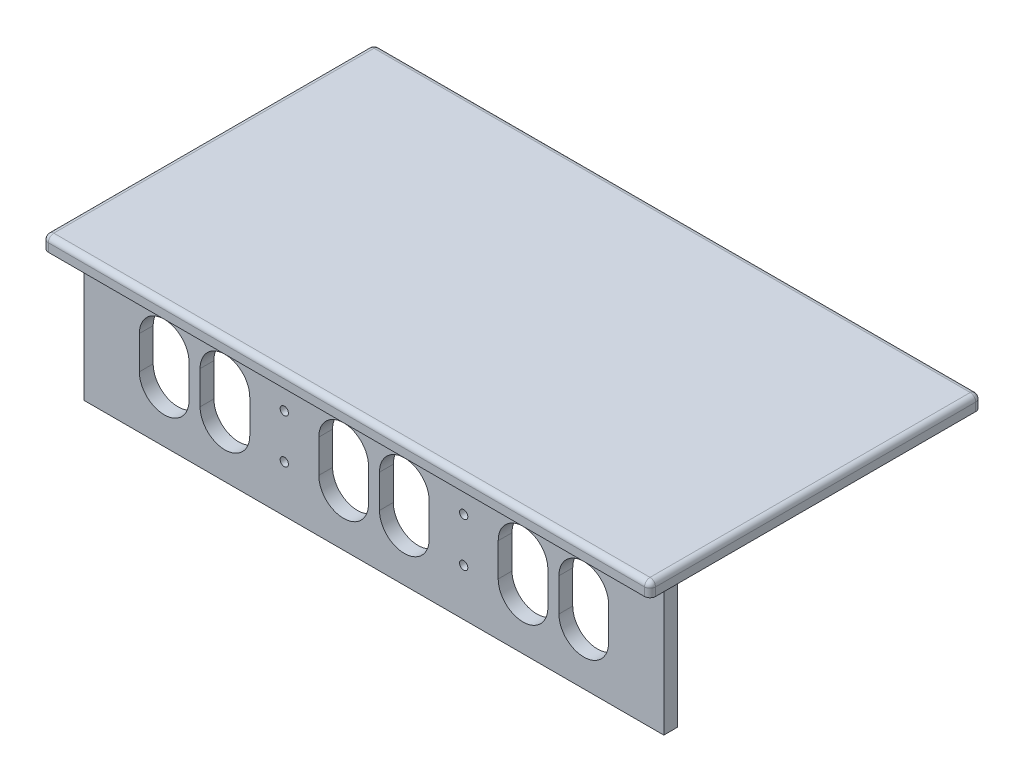
from build123d import *

# Parameters (mm, degrees)
CROQUIS1_W              = 220
CROQUIS1_H              = 120
SALIENTE_EXTRUIR1_DEPTH = 5
CROQUIS2_W              = 210
CROQUIS2_H              = 5
SALIENTE_EXTRUIR2_DEPTH = 50
CORTAR_EXTRUIR1_REACH   = 165.401
REDONDEO1_R             = 2
CORTAR_EXTRUIR3_REACH   = 165.401
CROQUIS11_R             = 1.5


with BuildPart() as part:
    # Croquis1 → Saliente-Extruir1 (new body)
    with BuildSketch(Plane(origin=(0, 0, 0), x_dir=(1, 0, 0), z_dir=(0, 1, 0))):
        Rectangle(CROQUIS1_W, CROQUIS1_H)
    extrude(amount=SALIENTE_EXTRUIR1_DEPTH)

    # Croquis2 → Saliente-Extruir2 (add)
    with BuildSketch(Plane.XZ):
        with Locations((0, 47.5)):
            Rectangle(CROQUIS2_W, CROQUIS2_H)
    extrude(amount=SALIENTE_EXTRUIR2_DEPTH)

    # Croquis3 → Cortar-Extruir1 (cut, up to next)
    with BuildSketch(Plane.XY.offset(50), mode=Mode.PRIVATE) as cortar_extruir1_sk1:
        with BuildLine():
            Line((-45, -19), (-45, -31))
            ThreePointArc((-45, -31), (-54, -40), (-63, -31))
            Line((-63, -31), (-63, -19))
            ThreePointArc((-63, -19), (-54, -10), (-45, -19))
        make_face()
    cortar_extruir1_tool1 = extrude(cortar_extruir1_sk1.sketch, amount=-CORTAR_EXTRUIR1_REACH, mode=Mode.PRIVATE) & part.part
    # Croquis3 → Cortar-Extruir1 (cut, up to next)
    with BuildSketch(Plane.XY.offset(50), mode=Mode.PRIVATE) as cortar_extruir1_sk2:
        with BuildLine():
            Line((-85, -19), (-85, -31))
            ThreePointArc((-85, -31), (-76, -40), (-67, -31))
            Line((-67, -31), (-67, -19))
            ThreePointArc((-67, -19), (-76, -10), (-85, -19))
        make_face()
    cortar_extruir1_tool2 = extrude(cortar_extruir1_sk2.sketch, amount=-CORTAR_EXTRUIR1_REACH, mode=Mode.PRIVATE) & part.part
    # Croquis3 → Cortar-Extruir1 (cut, up to next)
    with BuildSketch(Plane.XY.offset(50), mode=Mode.PRIVATE) as cortar_extruir1_sk3:
        with BuildLine():
            Line((20, -19), (20, -31))
            ThreePointArc((20, -31), (11, -40), (2, -31))
            Line((2, -31), (2, -19))
            ThreePointArc((2, -19), (11, -10), (20, -19))
        make_face()
    cortar_extruir1_tool3 = extrude(cortar_extruir1_sk3.sketch, amount=-CORTAR_EXTRUIR1_REACH, mode=Mode.PRIVATE) & part.part
    # Croquis3 → Cortar-Extruir1 (cut, up to next)
    with BuildSketch(Plane.XY.offset(50), mode=Mode.PRIVATE) as cortar_extruir1_sk4:
        with BuildLine():
            Line((-2, -19), (-2, -31))
            ThreePointArc((-2, -31), (-11, -40), (-20, -31))
            Line((-20, -31), (-20, -19))
            ThreePointArc((-20, -19), (-11, -10), (-2, -19))
        make_face()
    cortar_extruir1_tool4 = extrude(cortar_extruir1_sk4.sketch, amount=-CORTAR_EXTRUIR1_REACH, mode=Mode.PRIVATE) & part.part
    # Croquis3 → Cortar-Extruir1 (cut, up to next)
    with BuildSketch(Plane.XY.offset(50), mode=Mode.PRIVATE) as cortar_extruir1_sk5:
        with BuildLine():
            Line((85, -19), (85, -31))
            ThreePointArc((85, -31), (76, -40), (67, -31))
            Line((67, -31), (67, -19))
            ThreePointArc((67, -19), (76, -10), (85, -19))
        make_face()
    cortar_extruir1_tool5 = extrude(cortar_extruir1_sk5.sketch, amount=-CORTAR_EXTRUIR1_REACH, mode=Mode.PRIVATE) & part.part
    # Croquis3 → Cortar-Extruir1 (cut, up to next)
    with BuildSketch(Plane.XY.offset(50), mode=Mode.PRIVATE) as cortar_extruir1_sk6:
        with BuildLine():
            Line((63, -19), (63, -31))
            ThreePointArc((63, -31), (54, -40), (45, -31))
            Line((45, -31), (45, -19))
            ThreePointArc((45, -19), (54, -10), (63, -19))
        make_face()
    cortar_extruir1_tool6 = extrude(cortar_extruir1_sk6.sketch, amount=-CORTAR_EXTRUIR1_REACH, mode=Mode.PRIVATE) & part.part
    add(cortar_extruir1_tool1.solids().sort_by_distance((-54, -25, 50))[0], mode=Mode.SUBTRACT)
    add(cortar_extruir1_tool2.solids().sort_by_distance((-76, -25, 50))[0], mode=Mode.SUBTRACT)
    add(cortar_extruir1_tool3.solids().sort_by_distance((11, -25, 50))[0], mode=Mode.SUBTRACT)
    add(cortar_extruir1_tool4.solids().sort_by_distance((-11, -25, 50))[0], mode=Mode.SUBTRACT)
    add(cortar_extruir1_tool5.solids().sort_by_distance((76, -25, 50))[0], mode=Mode.SUBTRACT)
    add(cortar_extruir1_tool6.solids().sort_by_distance((54, -25, 50))[0], mode=Mode.SUBTRACT)

    # Redondeo1
    redondeo1_edges = [part.edges().sort_by_distance(p)[0] for p in [
        (-110, 5, 0),
        (0, 5, 60),
        (110, 5, 0),
        (110, 2.5, 60),
        (-110, 2.5, 60),
        (-110, 2.5, -60),
        (110, 2.5, -60),
        (0, 5, -60),
    ]]
    fillet(redondeo1_edges, radius=REDONDEO1_R)

    # Croquis11 → Cortar-Extruir3 (cut, up to next)
    with BuildSketch(Plane.XY.offset(50), mode=Mode.PRIVATE) as cortar_extruir3_sk1:
        with Locations((-32.5, -17)):
            Circle(CROQUIS11_R)
    cortar_extruir3_tool1 = extrude(cortar_extruir3_sk1.sketch, amount=-CORTAR_EXTRUIR3_REACH, mode=Mode.PRIVATE) & part.part
    # Croquis11 → Cortar-Extruir3 (cut, up to next)
    with BuildSketch(Plane.XY.offset(50), mode=Mode.PRIVATE) as cortar_extruir3_sk2:
        with Locations((-32.5, -33)):
            Circle(CROQUIS11_R)
    cortar_extruir3_tool2 = extrude(cortar_extruir3_sk2.sketch, amount=-CORTAR_EXTRUIR3_REACH, mode=Mode.PRIVATE) & part.part
    # Croquis11 → Cortar-Extruir3 (cut, up to next)
    with BuildSketch(Plane.XY.offset(50), mode=Mode.PRIVATE) as cortar_extruir3_sk3:
        with Locations((32.5, -17)):
            Circle(CROQUIS11_R)
    cortar_extruir3_tool3 = extrude(cortar_extruir3_sk3.sketch, amount=-CORTAR_EXTRUIR3_REACH, mode=Mode.PRIVATE) & part.part
    # Croquis11 → Cortar-Extruir3 (cut, up to next)
    with BuildSketch(Plane.XY.offset(50), mode=Mode.PRIVATE) as cortar_extruir3_sk4:
        with Locations((32.5, -33)):
            Circle(CROQUIS11_R)
    cortar_extruir3_tool4 = extrude(cortar_extruir3_sk4.sketch, amount=-CORTAR_EXTRUIR3_REACH, mode=Mode.PRIVATE) & part.part
    add(cortar_extruir3_tool1.solids().sort_by_distance((-32.5, -17, 50))[0], mode=Mode.SUBTRACT)
    add(cortar_extruir3_tool2.solids().sort_by_distance((-32.5, -33, 50))[0], mode=Mode.SUBTRACT)
    add(cortar_extruir3_tool3.solids().sort_by_distance((32.5, -17, 50))[0], mode=Mode.SUBTRACT)
    add(cortar_extruir3_tool4.solids().sort_by_distance((32.5, -33, 50))[0], mode=Mode.SUBTRACT)


solid = part.part
